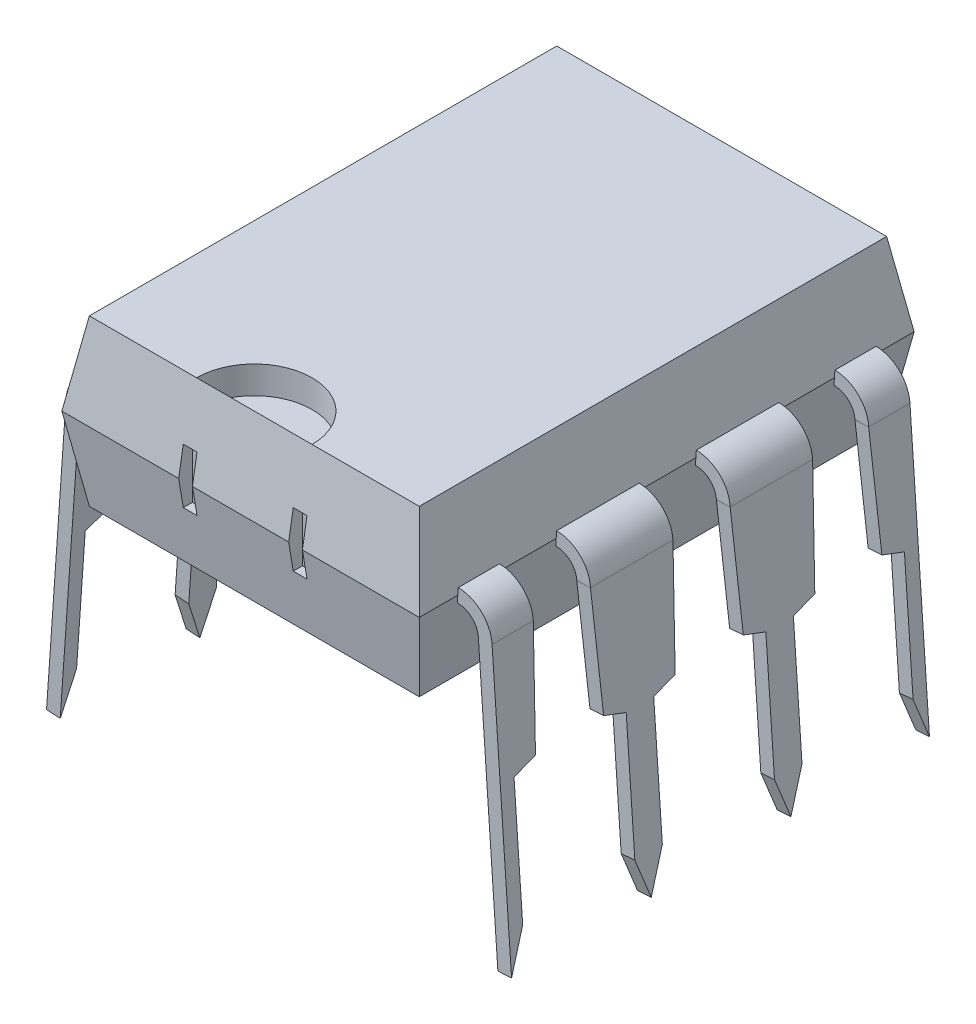
from build123d import *

# Parameters (mm, degrees)
CUT_EXTRUDE3_DEPTH = 0.5
SKETCH3_W          = 0.25
SKETCH3_H          = 1
CUT_EXTRUDE1_DEPTH = 0.25
SKETCH5_W          = 0.25
SKETCH5_H          = 1.5
CUT_EXTRUDE2_DEPTH = 0.249391013
LPATTERN1_COUNT    = 3
LPATTERN1_PITCH    = 2.54
CUT_EXTRUDE5_REACH = 13.775
SKETCH8_W          = 0.813078276
SKETCH8_H          = 5.718154448
SKETCH9_W          = 0.25
SKETCH9_H          = 1
CUT_EXTRUDE6_DEPTH = 0.25


with BuildPart() as part:
    # Sketch1 → Loft1 section 0
    with BuildSketch(Plane(origin=(0, 0, 0), x_dir=(1, 0, 0), z_dir=(0, 1, 0))):
        with BuildLine():
            Line((-3, 4.25), (3, 4.25))
            Line((3, 4.25), (3, -4.25))
            Line((3, -4.25), (-3, -4.25))
            Line((-3, -4.25), (-3, 4.25))
        make_face()
    # Sketch2 → Loft1 section 1
    with BuildSketch(Plane(origin=(0, -1.5, 0), x_dir=(1, 0, 0), z_dir=(0, 1, 0))):
        with BuildLine():
            Line((3.25, -4.5), (-3.25, -4.5))
            Line((-3.25, -4.5), (-3.25, 4.5))
            Line((-3.25, 4.5), (3.25, 4.5))
            Line((3.25, 4.5), (3.25, -4.5))
        make_face()
    loft1 = loft()


with BuildPart() as mirror1_1:
    # Mirror1: Loft1 across Plane1
    add(loft1.mirror(Plane(origin=(0, -1.5, 0), x_dir=(1, 0, 0), z_dir=(0, 1, 0))))


with BuildPart() as part_1:
    add(part.part)

    # Mirror1 united with what the copies touc: union Mirror1_1
    add(mirror1_1.part)

    # Sketch7 → Cut-Extrude3 (cut)
    with BuildSketch(Plane(origin=(0, 0, 0), x_dir=(1, 0, 0), z_dir=(0, 1, 0))):
        with BuildLine():
            Line((-1.05, -4.25), (1.05, -4.25))
            ThreePointArc((1.05, -4.25), (0, -3.2), (-1.05, -4.25))
        make_face()
    extrude(amount=-CUT_EXTRUDE3_DEPTH, mode=Mode.SUBTRACT)

    # Sketch3 → Cut-Extrude1 (cut)
    with BuildSketch(Plane.XY.offset(4.5)):
        with Locations((-1, -1.5)):
            Rectangle(SKETCH3_W, SKETCH3_H)
        with Locations((1, -1.5)):
            Rectangle(SKETCH3_W, SKETCH3_H)
    extrude(amount=-CUT_EXTRUDE1_DEPTH, mode=Mode.SUBTRACT)

    # Sketch9 → Cut-Extrude6 (cut)
    with BuildSketch(Plane.XY.offset(-4.5)):
        with Locations((-0.003175804, -1.525987699)):
            Rectangle(SKETCH9_W, SKETCH9_H)
    extrude(amount=CUT_EXTRUDE6_DEPTH, mode=Mode.SUBTRACT)


with BuildPart() as body_2:
    # Sweep1: sweep along a path in Sketch4
    with BuildLine(Plane.XY.offset(3.8)) as sweep1_path:
        Line((4.104540041, -7.052698419), (3.748782025, -1.965121763))
        ThreePointArc((3.748782025, -1.965121763), (3.59099918, -1.634323149), (3.25, -1.5))
    # Sketch5 → Sweep1 (sweep)
    with BuildSketch(Plane(origin=(0, -7.052698419, 0), x_dir=(1, 0, 0), z_dir=(0, 1, 0))):
        with Locations((4.104540041, -3.8)):
            Rectangle(SKETCH5_W, SKETCH5_H)
    sweep(path=sweep1_path.line)

    # Sketch6 → Cut-Extrude2 (cut)
    with BuildSketch(Plane(origin=(3.71818629, 0.260000913, 0), x_dir=(0, 0, -1), z_dir=(0.9975640502598243, 0.06975647374412597, 0))):
        Polygon((-3.15, -4.230556199), (-3.55, -4.376144293), (-3.55, -6.630556199), (-3.8, -7.317425554), (-4.05, -6.630556199), (-4.05, -4.376144293), (-4.45, -4.230556199), (-4.55, -2.230556199), (-4.55, -3.830556199), (-4.55, -7.330556199), (-3.05, -7.330556199), (-3.05, -3.830556199), (-3.05, -2.230556199), align=None)
    extrude(amount=-CUT_EXTRUDE2_DEPTH, mode=Mode.SUBTRACT)


with BuildPart() as lpattern1_1:
    # LPattern1: pattern copy
    add(body_2.part.moved(Location(Vector(0, 0, -1) * (1 * LPATTERN1_PITCH))))


with BuildPart() as lpattern1_2:
    # LPattern1: pattern copy
    add(body_2.part.moved(Location(Vector(0, 0, -1) * (2 * LPATTERN1_PITCH))))


with BuildPart() as body_2_1:
    add(body_2.part)

    # Cut-Extrude5: up to this plane
    cut_extrude5_end = Plane(origin=(2.96368176, -5.594541588, 0), z_dir=(0.9975640502598243, -0.06975647374412595, 0))
    # Sketch8 → Cut-Extrude5 (cut, up to the surface)
    with BuildSketch(Plane(origin=(4.71575034, 0.329757387, 0), x_dir=(0, 0, -1), z_dir=(0.9975640502598243, 0.06975647374412597, 0)), mode=Mode.PRIVATE) as cut_extrude5_sk1:
        with Locations((-4.206539138, -4.45834833)):
            Rectangle(SKETCH8_W, SKETCH8_H)
    cut_extrude5_tool1 = split(extrude(cut_extrude5_sk1.sketch, amount=-CUT_EXTRUDE5_REACH, mode=Mode.PRIVATE), bisect_by=cut_extrude5_end, keep=Keep.BOTH, mode=Mode.PRIVATE)
    add(cut_extrude5_tool1.solids().sort_by_distance((5.026749, -4.117731, 4.206539))[0], mode=Mode.SUBTRACT)


with BuildPart() as body_5:
    # Mirror4: mirrored copy
    add(body_2_1.part.mirror(Plane.XY))


with BuildPart() as body_6:
    # Mirror5: mirrored copy
    add(lpattern1_1.part.mirror(Plane(origin=(0, 0, 0), x_dir=(0, 0, 1), z_dir=(1, 0, 0))))


with BuildPart() as body_7:
    # Mirror5 2: mirrored copy
    add(lpattern1_2.part.mirror(Plane(origin=(0, 0, 0), x_dir=(0, 0, 1), z_dir=(1, 0, 0))))


with BuildPart() as body_8:
    # Mirror5 3: mirrored copy
    add(body_5.part.mirror(Plane(origin=(0, 0, 0), x_dir=(0, 0, 1), z_dir=(1, 0, 0))))


with BuildPart() as body_9:
    # Mirror5 4: mirrored copy
    add(body_2_1.part.mirror(Plane(origin=(0, 0, 0), x_dir=(0, 0, 1), z_dir=(1, 0, 0))))


solid = Compound([part_1.part, lpattern1_1.part, lpattern1_2.part, body_2_1.part, body_5.part, body_6.part, body_7.part, body_8.part, body_9.part])
